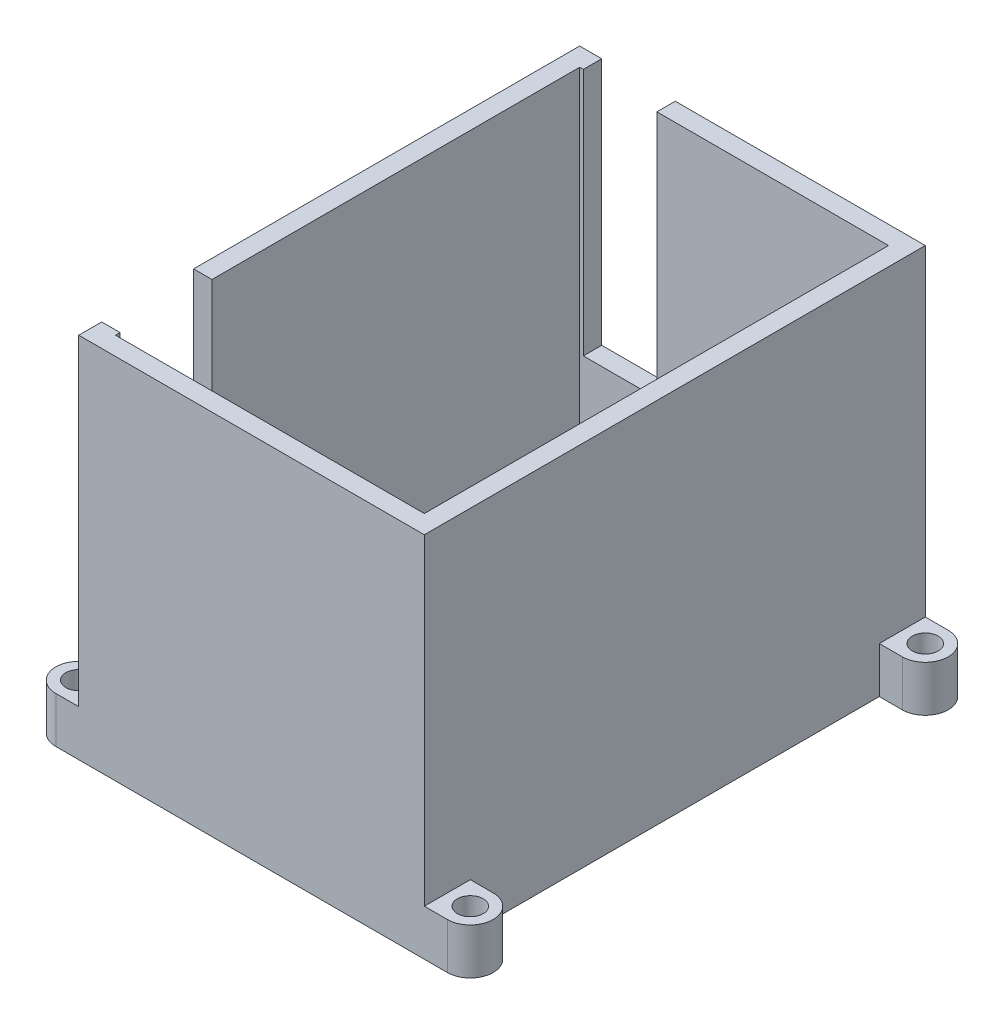
from build123d import *

# Parameters (mm, degrees)
SKETCH1_W                       = 47.752
SKETCH1_H                       = 69.215
SKETCH1_W_2                     = 42.672
SKETCH1_H_2                     = 64.135
BOSS_EXTRUDE1_DEPTH             = 50.8
BOSS_EXTRUDE2_DEPTH             = 6.35
F_9_64_0_14063_DIAMETER_HOLE1_D = 3.572002
SKETCH11_W                      = 12.7
SKETCH11_H                      = 36.195
CUT_EXTRUDE1_DEPTH              = 6.35
SKETCH12_W                      = 10.16
SKETCH12_H                      = 34.29
CUT_EXTRUDE2_DEPTH              = 6.35


with BuildPart() as part:
    # Sketch1 → Boss-Extrude1 (new body)
    with BuildSketch(Plane(origin=(0, 0, 0), x_dir=(1, 0, 0), z_dir=(0, 1, 0))):
        with Locations((21.336, 32.0675)):
            Rectangle(SKETCH1_W, SKETCH1_H)
        with Locations((21.336, 32.0675)):
            Rectangle(SKETCH1_W_2, SKETCH1_H_2, mode=Mode.SUBTRACT)
    extrude(amount=BOSS_EXTRUDE1_DEPTH)

    # Sketch2 → Boss-Extrude2 (add)
    with BuildSketch(Plane.XZ):
        with BuildLine():
            Line((-5.715, -3.81), (-2.54, -3.81))
            Line((-2.54, -3.81), (-2.54, 2.54))
            Line((-2.54, 2.54), (-5.715, 2.54))
            ThreePointArc((-5.715, 2.54), (-8.89, -0.635), (-5.715, -3.81))
        make_face()
        with BuildLine():
            Line((48.387, -60.325), (45.212, -60.325))
            Line((45.212, -60.325), (45.212, -66.675))
            Line((45.212, -66.675), (48.387, -66.675))
            ThreePointArc((48.387, -66.675), (51.562, -63.5), (48.387, -60.325))
        make_face()
        with BuildLine():
            Line((-2.54, -66.675), (-5.715, -66.675))
            ThreePointArc((-5.715, -66.675), (-8.89, -63.5), (-5.715, -60.325))
            Line((-5.715, -60.325), (-2.54, -60.325))
            Line((-2.54, -60.325), (-2.54, -66.675))
        make_face()
        with BuildLine():
            Line((45.212, 2.54), (48.387, 2.54))
            ThreePointArc((48.387, 2.54), (51.562, -0.635), (48.387, -3.81))
            Line((48.387, -3.81), (45.212, -3.81))
            Line((45.212, -3.81), (45.212, 2.54))
        make_face()
    extrude(amount=-BOSS_EXTRUDE2_DEPTH)

    # 9/64 (0.14063) Diameter Hole1 (through all)
    with Locations(Plane(origin=(0, 6.35, 0), x_dir=(1, 0, 0), z_dir=(0, 1, 0))):
        with Locations((-5.715, 0.635), (-5.715, 63.5), (48.387, 63.5), (48.387, 0.635)):
            Hole(F_9_64_0_14063_DIAMETER_HOLE1_D / 2)

    # Sketch11 → Cut-Extrude1 (cut)
    with BuildSketch(Plane.ZY.offset(2.54)):
        with Locations((-6.985, 32.7025)):
            Rectangle(SKETCH11_W, SKETCH11_H)
    extrude(amount=-CUT_EXTRUDE1_DEPTH, mode=Mode.SUBTRACT)

    # Sketch12 → Cut-Extrude2 (cut)
    with BuildSketch(Plane(origin=(0, 0, -66.675), x_dir=(-1, 0, 0), z_dir=(0, 0, -1))):
        with Locations((-5.588, 33.655)):
            Rectangle(SKETCH12_W, SKETCH12_H)
    extrude(amount=-CUT_EXTRUDE2_DEPTH, mode=Mode.SUBTRACT)


solid = part.part
